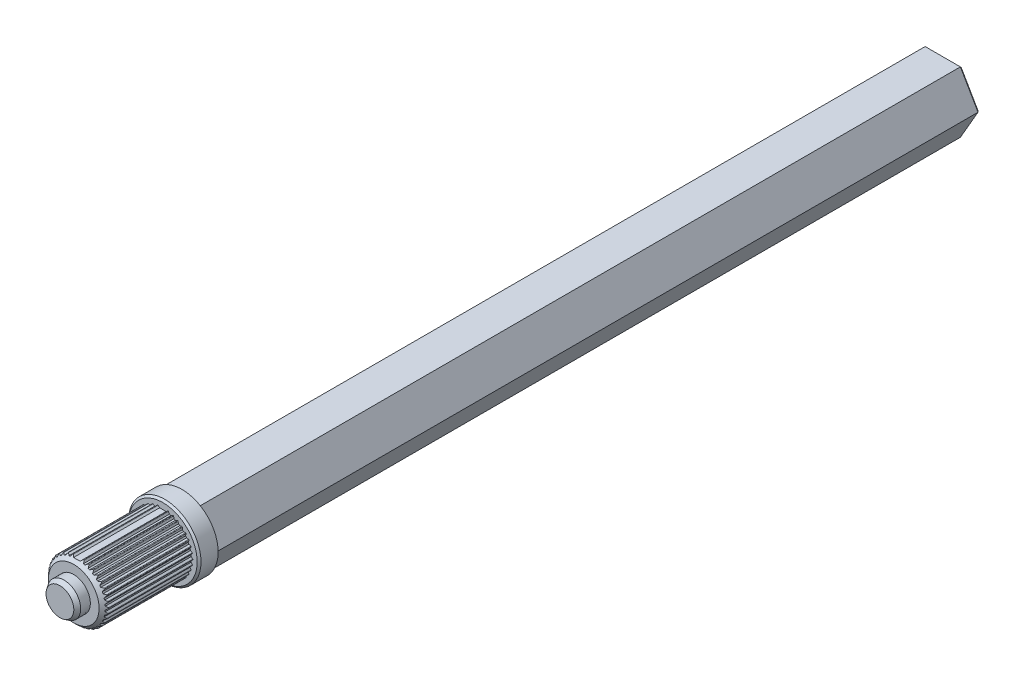
from build123d import *

# Parameters (mm, degrees)
Y_KSEKLIK_EKSTR_ZYON1_DEPTH = 200
IZIM2_R                     = 9.5
Y_KSEKLIK_EKSTR_ZYON2_DEPTH = 5
Y_KSEKLIK_EKSTR_ZYON3_DEPTH = 27
PAH1_SIZE                   = 0.5


with BuildPart() as part:
    # Çizim1 → Yükseklik-Ekstrüzyon1 (new body)
    with BuildSketch(Plane.XY):
        Polygon((9.237604307, 0), (4.618802154, 8), (-4.618802154, 8), (-9.237604307, 0), (-4.618802154, -8), (4.618802154, -8), align=None)
    extrude(amount=Y_KSEKLIK_EKSTR_ZYON1_DEPTH)

    # Çizim2 → Yükseklik-Ekstrüzyon2 (add)
    with BuildSketch(Plane.XY.offset(200)):
        Circle(IZIM2_R)
    extrude(amount=Y_KSEKLIK_EKSTR_ZYON2_DEPTH)

    # Çizim3 → Yükseklik-Ekstrüzyon3 (add)
    with BuildSketch(Plane.XY.offset(205)):
        with BuildLine():
            Line((5.932852577, 5.108414624), (5.40374633, 5.108414624))
            ThreePointArc((5.40374633, 5.108414624), (5.258154352, 5.258154352), (5.108414624, 5.40374633))
            Line((5.108414624, 5.40374633), (5.108414624, 5.932852577))
            ThreePointArc((5.108414624, 5.932852577), (5.061919783, 6.032561087), (4.955652325, 6.061035366))
            Line((4.955652325, 6.061035366), (4.434584391, 5.96915703))
            ThreePointArc((4.434584391, 5.96915703), (4.265202251, 6.091340093), (4.092455625, 6.208718171))
            Line((4.092455625, 6.208718171), (4.000577289, 6.729786106))
            ThreePointArc((4.000577289, 6.729786106), (3.937474608, 6.819906075), (3.827877085, 6.829494615))
            Line((3.827877085, 6.829494615), (3.330679849, 6.648529621))
            ThreePointArc((3.330679849, 6.648529621), (3.142654138, 6.739443548), (2.952149432, 6.825041253))
            Line((2.952149432, 6.825041253), (2.771184438, 7.322238489))
            ThreePointArc((2.771184438, 7.322238489), (2.69339126, 7.400031667), (2.583793737, 7.390443126))
            Line((2.583793737, 7.390443126), (2.125574285, 7.125890003))
            ThreePointArc((2.125574285, 7.125890003), (1.92461807, 7.182772421), (1.722143673, 7.23398891))
            Line((1.722143673, 7.23398891), (1.457590549, 7.692208361))
            ThreePointArc((1.457590549, 7.692208361), (1.367470581, 7.755311042), (1.261203123, 7.726836763))
            Line((1.261203123, 7.726836763), (0.855884222, 7.386733823))
            Line((0.855884222, 7.386733823), (-0.855884222, 7.386733823))
            Line((-0.855884222, 7.386733823), (-1.261203123, 7.726836763))
            ThreePointArc((-1.261203123, 7.726836763), (-1.367470581, 7.755311042), (-1.457590549, 7.692208361))
            Line((-1.457590549, 7.692208361), (-1.722143673, 7.23398891))
            ThreePointArc((-1.722143673, 7.23398891), (-1.92461807, 7.182772421), (-2.125574285, 7.125890003))
            Line((-2.125574285, 7.125890003), (-2.583793737, 7.390443126))
            ThreePointArc((-2.583793737, 7.390443126), (-2.69339126, 7.400031667), (-2.771184438, 7.322238489))
            Line((-2.771184438, 7.322238489), (-2.952149432, 6.825041253))
            ThreePointArc((-2.952149432, 6.825041253), (-3.142654138, 6.739443548), (-3.330679849, 6.648529621))
            Line((-3.330679849, 6.648529621), (-3.827877085, 6.829494615))
            ThreePointArc((-3.827877085, 6.829494615), (-3.937474608, 6.819906075), (-4.000577289, 6.729786106))
            Line((-4.000577289, 6.729786106), (-4.092455625, 6.208718171))
            ThreePointArc((-4.092455625, 6.208718171), (-4.265202251, 6.091340093), (-4.434584391, 5.96915703))
            Line((-4.434584391, 5.96915703), (-4.955652325, 6.061035366))
            ThreePointArc((-4.955652325, 6.061035366), (-5.061919783, 6.032561087), (-5.108414624, 5.932852577))
            Line((-5.108414624, 5.932852577), (-5.108414624, 5.40374633))
            ThreePointArc((-5.108414624, 5.40374633), (-5.258154352, 5.258154352), (-5.40374633, 5.108414624))
            Line((-5.40374633, 5.108414624), (-5.932852577, 5.108414624))
            ThreePointArc((-5.932852577, 5.108414624), (-6.032561087, 5.061919783), (-6.061035366, 4.955652325))
            Line((-6.061035366, 4.955652325), (-5.96915703, 4.434584391))
            ThreePointArc((-5.96915703, 4.434584391), (-6.091340093, 4.265202251), (-6.208718171, 4.092455625))
            Line((-6.208718171, 4.092455625), (-6.729786106, 4.000577289))
            ThreePointArc((-6.729786106, 4.000577289), (-6.819906075, 3.937474608), (-6.829494615, 3.827877085))
            Line((-6.829494615, 3.827877085), (-6.648529621, 3.330679849))
            ThreePointArc((-6.648529621, 3.330679849), (-6.739443548, 3.142654138), (-6.825041253, 2.952149432))
            Line((-6.825041253, 2.952149432), (-7.322238489, 2.771184438))
            ThreePointArc((-7.322238489, 2.771184438), (-7.400031667, 2.69339126), (-7.390443126, 2.583793737))
            Line((-7.390443126, 2.583793737), (-7.125890003, 2.125574285))
            ThreePointArc((-7.125890003, 2.125574285), (-7.182772421, 1.92461807), (-7.23398891, 1.722143673))
            Line((-7.23398891, 1.722143673), (-7.692208361, 1.457590549))
            ThreePointArc((-7.692208361, 1.457590549), (-7.755311042, 1.367470581), (-7.726836763, 1.261203123))
            Line((-7.726836763, 1.261203123), (-7.386733823, 0.855884222))
            ThreePointArc((-7.386733823, 0.855884222), (-7.407856389, 0.648103455), (-7.423135474, 0.439811449))
            Line((-7.423135474, 0.439811449), (-7.828454374, 0.099708509))
            ThreePointArc((-7.828454374, 0.099708509), (-7.874949216, 0), (-7.828454374, -0.099708509))
            Line((-7.828454374, -0.099708509), (-7.423135474, -0.439811449))
            ThreePointArc((-7.423135474, -0.439811449), (-7.407856389, -0.648103455), (-7.386733823, -0.855884222))
            Line((-7.386733823, -0.855884222), (-7.726836763, -1.261203123))
            ThreePointArc((-7.726836763, -1.261203123), (-7.755311042, -1.367470581), (-7.692208361, -1.457590549))
            Line((-7.692208361, -1.457590549), (-7.23398891, -1.722143673))
            ThreePointArc((-7.23398891, -1.722143673), (-7.182772421, -1.92461807), (-7.125890003, -2.125574285))
            Line((-7.125890003, -2.125574285), (-7.390443126, -2.583793737))
            ThreePointArc((-7.390443126, -2.583793737), (-7.400031667, -2.69339126), (-7.322238489, -2.771184438))
            Line((-7.322238489, -2.771184438), (-6.825041253, -2.952149432))
            ThreePointArc((-6.825041253, -2.952149432), (-6.739443548, -3.142654138), (-6.648529621, -3.330679849))
            Line((-6.648529621, -3.330679849), (-6.829494615, -3.827877085))
            ThreePointArc((-6.829494615, -3.827877085), (-6.819906075, -3.937474608), (-6.729786106, -4.000577289))
            Line((-6.729786106, -4.000577289), (-6.208718171, -4.092455625))
            ThreePointArc((-6.208718171, -4.092455625), (-6.091340093, -4.265202251), (-5.96915703, -4.434584391))
            Line((-5.96915703, -4.434584391), (-6.061035366, -4.955652325))
            ThreePointArc((-6.061035366, -4.955652325), (-6.032561087, -5.061919783), (-5.932852577, -5.108414624))
            Line((-5.932852577, -5.108414624), (-5.40374633, -5.108414624))
            ThreePointArc((-5.40374633, -5.108414624), (-5.258154352, -5.258154352), (-5.108414624, -5.40374633))
            Line((-5.108414624, -5.40374633), (-5.108414624, -5.932852577))
            ThreePointArc((-5.108414624, -5.932852577), (-5.061919783, -6.032561087), (-4.955652325, -6.061035366))
            Line((-4.955652325, -6.061035366), (-4.434584391, -5.96915703))
            ThreePointArc((-4.434584391, -5.96915703), (-4.265202251, -6.091340093), (-4.092455625, -6.208718171))
            Line((-4.092455625, -6.208718171), (-4.000577289, -6.729786106))
            ThreePointArc((-4.000577289, -6.729786106), (-3.937474608, -6.819906075), (-3.827877085, -6.829494615))
            Line((-3.827877085, -6.829494615), (-3.330679849, -6.648529621))
            ThreePointArc((-3.330679849, -6.648529621), (-3.142654138, -6.739443548), (-2.952149432, -6.825041253))
            Line((-2.952149432, -6.825041253), (-2.771184438, -7.322238489))
            ThreePointArc((-2.771184438, -7.322238489), (-2.69339126, -7.400031667), (-2.583793737, -7.390443126))
            Line((-2.583793737, -7.390443126), (-2.125574285, -7.125890003))
            ThreePointArc((-2.125574285, -7.125890003), (-1.92461807, -7.182772421), (-1.722143673, -7.23398891))
            Line((-1.722143673, -7.23398891), (-1.457590549, -7.692208361))
            ThreePointArc((-1.457590549, -7.692208361), (-1.367470581, -7.755311042), (-1.261203123, -7.726836763))
            Line((-1.261203123, -7.726836763), (-0.855884222, -7.386733823))
            ThreePointArc((-0.855884222, -7.386733823), (-0.648103455, -7.407856389), (-0.439811449, -7.423135474))
            Line((-0.439811449, -7.423135474), (-0.099708509, -7.828454374))
            ThreePointArc((-0.099708509, -7.828454374), (0, -7.874949216), (0.099708509, -7.828454374))
            Line((0.099708509, -7.828454374), (0.439811449, -7.423135474))
            ThreePointArc((0.439811449, -7.423135474), (0.648103455, -7.407856389), (0.855884222, -7.386733823))
            Line((0.855884222, -7.386733823), (1.261203123, -7.726836763))
            ThreePointArc((1.261203123, -7.726836763), (1.367470581, -7.755311042), (1.457590549, -7.692208361))
            Line((1.457590549, -7.692208361), (1.722143673, -7.23398891))
            ThreePointArc((1.722143673, -7.23398891), (1.92461807, -7.182772421), (2.125574285, -7.125890003))
            Line((2.125574285, -7.125890003), (2.583793737, -7.390443126))
            ThreePointArc((2.583793737, -7.390443126), (2.69339126, -7.400031667), (2.771184438, -7.322238489))
            Line((2.771184438, -7.322238489), (2.952149432, -6.825041253))
            ThreePointArc((2.952149432, -6.825041253), (3.142654138, -6.739443548), (3.330679849, -6.648529621))
            Line((3.330679849, -6.648529621), (3.827877085, -6.829494615))
            ThreePointArc((3.827877085, -6.829494615), (3.937474608, -6.819906075), (4.000577289, -6.729786106))
            Line((4.000577289, -6.729786106), (4.092455625, -6.208718171))
            ThreePointArc((4.092455625, -6.208718171), (4.265202251, -6.091340093), (4.434584391, -5.96915703))
            Line((4.434584391, -5.96915703), (4.955652325, -6.061035366))
            ThreePointArc((4.955652325, -6.061035366), (5.061919783, -6.032561087), (5.108414624, -5.932852577))
            Line((5.108414624, -5.932852577), (5.108414624, -5.40374633))
            ThreePointArc((5.108414624, -5.40374633), (5.258154352, -5.258154352), (5.40374633, -5.108414624))
            Line((5.40374633, -5.108414624), (5.932852577, -5.108414624))
            ThreePointArc((5.932852577, -5.108414624), (6.032561087, -5.061919783), (6.061035366, -4.955652325))
            Line((6.061035366, -4.955652325), (5.96915703, -4.434584391))
            ThreePointArc((5.96915703, -4.434584391), (6.091340093, -4.265202251), (6.208718171, -4.092455625))
            Line((6.208718171, -4.092455625), (6.729786106, -4.000577289))
            ThreePointArc((6.729786106, -4.000577289), (6.819906075, -3.937474608), (6.829494615, -3.827877085))
            Line((6.829494615, -3.827877085), (6.648529621, -3.330679849))
            ThreePointArc((6.648529621, -3.330679849), (6.739443548, -3.142654138), (6.825041253, -2.952149432))
            Line((6.825041253, -2.952149432), (7.322238489, -2.771184438))
            ThreePointArc((7.322238489, -2.771184438), (7.400031667, -2.69339126), (7.390443126, -2.583793737))
            Line((7.390443126, -2.583793737), (7.125890003, -2.125574285))
            ThreePointArc((7.125890003, -2.125574285), (7.182772421, -1.92461807), (7.23398891, -1.722143673))
            Line((7.23398891, -1.722143673), (7.692208361, -1.457590549))
            ThreePointArc((7.692208361, -1.457590549), (7.755311042, -1.367470581), (7.726836763, -1.261203123))
            Line((7.726836763, -1.261203123), (7.386733823, -0.855884222))
            ThreePointArc((7.386733823, -0.855884222), (7.407856389, -0.648103455), (7.423135474, -0.439811449))
            Line((7.423135474, -0.439811449), (7.828454374, -0.099708509))
            ThreePointArc((7.828454374, -0.099708509), (7.874949216, 0), (7.828454374, 0.099708509))
            Line((7.828454374, 0.099708509), (7.423135474, 0.439811449))
            ThreePointArc((7.423135474, 0.439811449), (7.407856389, 0.648103455), (7.386733823, 0.855884222))
            Line((7.386733823, 0.855884222), (7.726836763, 1.261203123))
            ThreePointArc((7.726836763, 1.261203123), (7.755311042, 1.367470581), (7.692208361, 1.457590549))
            Line((7.692208361, 1.457590549), (7.23398891, 1.722143673))
            ThreePointArc((7.23398891, 1.722143673), (7.182772421, 1.92461807), (7.125890003, 2.125574285))
            Line((7.125890003, 2.125574285), (7.390443126, 2.583793737))
            ThreePointArc((7.390443126, 2.583793737), (7.400031667, 2.69339126), (7.322238489, 2.771184438))
            Line((7.322238489, 2.771184438), (6.825041253, 2.952149432))
            ThreePointArc((6.825041253, 2.952149432), (6.739443548, 3.142654138), (6.648529621, 3.330679849))
            Line((6.648529621, 3.330679849), (6.829494615, 3.827877085))
            ThreePointArc((6.829494615, 3.827877085), (6.819906075, 3.937474608), (6.729786106, 4.000577289))
            Line((6.729786106, 4.000577289), (6.208718171, 4.092455625))
            ThreePointArc((6.208718171, 4.092455625), (6.091340093, 4.265202251), (5.96915703, 4.434584391))
            Line((5.96915703, 4.434584391), (6.061035366, 4.955652325))
            ThreePointArc((6.061035366, 4.955652325), (6.032561087, 5.061919783), (5.932852577, 5.108414624))
        make_face()
    extrude(amount=Y_KSEKLIK_EKSTR_ZYON3_DEPTH)

    # Çizim6 → Kes-Döndür2 (revolve, cut)
    with BuildSketch(Plane(origin=(0, 0, 0), x_dir=(1, 0, 0), z_dir=(0, 1, 0)), mode=Mode.PRIVATE) as kes_d_nd_r2_sk:
        Polygon((7.912737039, -227.021634158), (6.65176164, -228.372005098), (4.353128201, -228.372229851), (4.353375318, -230.899597622), (3.644102447, -231.999643692), (0, -232), (0, -234.555514857), (11.626013571, -234.555514857), (11.626013571, -227.126236171), (8.280169938, -227.126236171), align=None)
    revolve(kes_d_nd_r2_sk.sketch.rotate(Axis((0, 0, 232), (0, 0, 1)), 180), axis=Axis((0, 0, 232), (0, 0, 1)), mode=Mode.SUBTRACT)

    # Pah1
    pah1_edges = [part.edges().sort_by_distance(p)[0] for p in [
        (-9.5, 0, 205),
        (0, -8, 0),
        (-6.92820323, -4, 0),
        (-6.92820323, 4, 0),
        (0, 8, 0),
        (6.92820323, 4, 0),
        (6.92820323, -4, 0),
    ]]
    chamfer(pah1_edges, length=PAH1_SIZE)


solid = part.part
